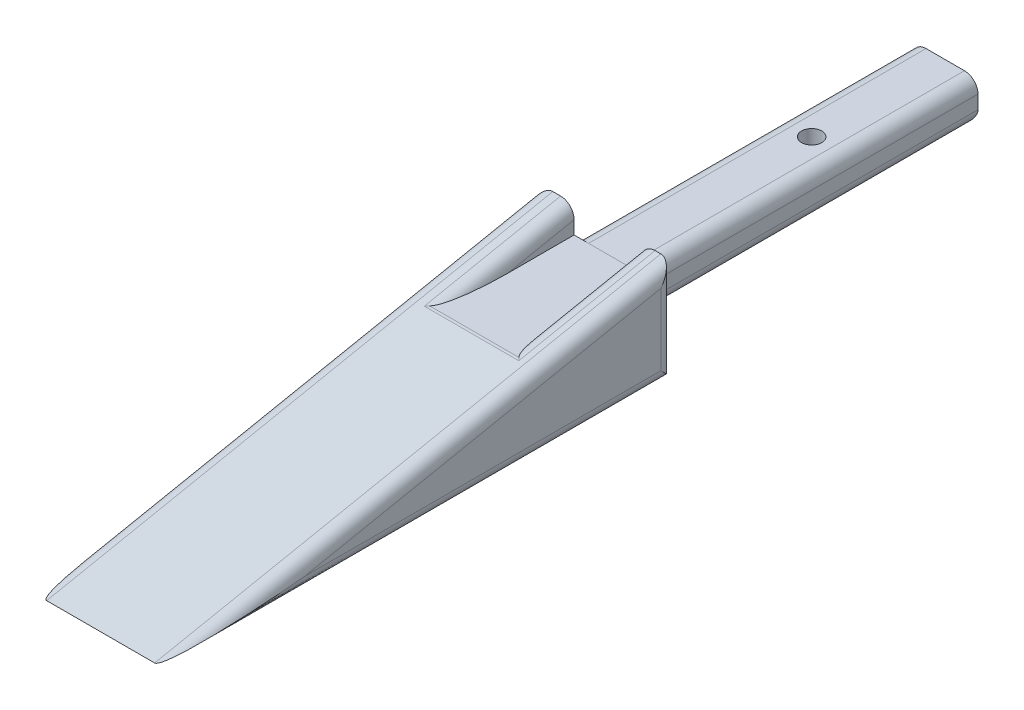
from build123d import *

# Parameters (mm, degrees)
SKETCH1_W           = 9.7
SKETCH1_H           = 6
BOSS_EXTRUDE3_DEPTH = 50
BOSS_EXTRUDE4_START = 5
BOSS_EXTRUDE4_DEPTH = 20
FILLET1_R           = 2
CUT_EXTRUDE1_REACH  = 127.666
SKETCH6_W           = 10
SKETCH6_H           = 4
FILLET2_R           = 2
SKETCH7_R           = 1.5
CUT_EXTRUDE2_DEPTH  = 7


with BuildPart() as part:
    # Sketch1 → Boss-Extrude3 (new body)
    with BuildSketch(Plane.XY):
        Rectangle(SKETCH1_W, SKETCH1_H)
    extrude(amount=BOSS_EXTRUDE3_DEPTH)

    # Fillet1
    fillet1_edges = [part.edges().sort_by_distance(p)[0] for p in [
        (0, -3, 0),
        (4.85, -3, 25),
        (-4.85, -3, 25),
        (-4.85, 3, 25),
        (4.85, 3, 25),
    ]]
    fillet(fillet1_edges, radius=FILLET1_R)

    # Sketch7 → Cut-Extrude2 (cut)
    with BuildSketch(Plane(origin=(0, 3, 0), x_dir=(1, 0, 0), z_dir=(0, 1, 0))):
        with Locations(Location((0, -19.8, 0), (0, 0, 270))):
            Circle(SKETCH7_R)
    extrude(amount=-CUT_EXTRUDE2_DEPTH, mode=Mode.SUBTRACT)


with BuildPart() as body_2:
    # Sketch3 → Boss-Extrude4 (new body)
    with BuildSketch(Plane(origin=(4.85, 0, 0), x_dir=(0, 0, -1), z_dir=(1, 0, 0)).offset(BOSS_EXTRUDE4_START)):
        Polygon((-125, -8), (-50, -8), (-50, 7), align=None)
    extrude(amount=-BOSS_EXTRUDE4_DEPTH)

    # Cut-Extrude1: up to this face of the body (flat: up to its plane)
    cut_extrude1_end = Plane(body_2.part.faces().sort_by_distance((-0.15, -0.5, 87.5))[0])
    # Sketch6 → Cut-Extrude1 (cut, up to the picked face)
    with BuildSketch(Plane(origin=(0, 0, 0), x_dir=(-1, 0, 0), z_dir=(0, 0, -1)), mode=Mode.PRIVATE) as cut_extrude1_sk1:
        with Locations((0, 5)):
            Rectangle(SKETCH6_W, SKETCH6_H)
    cut_extrude1_tool1 = split(extrude(cut_extrude1_sk1.sketch, amount=-CUT_EXTRUDE1_REACH, mode=Mode.PRIVATE), bisect_by=cut_extrude1_end, keep=Keep.BOTH, mode=Mode.PRIVATE)
    add(cut_extrude1_tool1.solids().sort_by(Axis((0, 5, 0), (0, 0, 1)))[0], mode=Mode.SUBTRACT)

    # Fillet2
    fillet2_edges = [body_2.edges().sort_by_distance(p)[0] for p in [
        (-10.15, -0.5, 50),
        (5, 5, 60),
        (0, 3, 70),
        (-5, 5, 60),
        (9.85, -0.5, 50),
        (9.85, -8, 87.5),
        (9.85, -0.5, 87.5),
        (-10.15, -0.5, 87.5),
        (-10.15, -8, 87.5),
    ]]
    fillet(fillet2_edges, radius=FILLET2_R)


solid = Compound([part.part, body_2.part])
